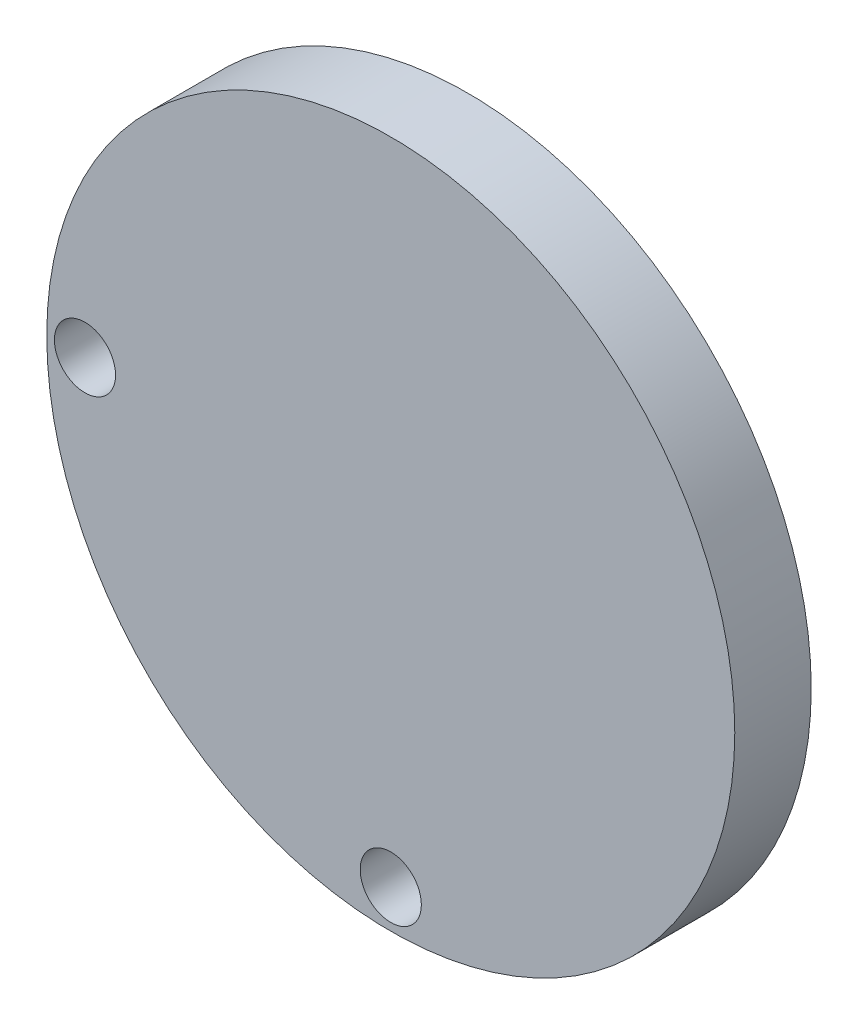
from build123d import *

# Parameters (mm, degrees)
SKETCH1_R           = 45
BOSS_EXTRUDE1_DEPTH = 5
SKETCH2_R           = 4
CUT_EXTRUDE1_DEPTH  = 10


with BuildPart() as part:
    # Sketch1 → Boss-Extrude1 (new, symmetric)
    with BuildSketch(Plane.XY):
        Circle(SKETCH1_R)
    extrude(amount=BOSS_EXTRUDE1_DEPTH, both=True)

    # Sketch2 → Cut-Extrude1 (cut)
    with BuildSketch(Plane.XY.offset(5)):
        with Locations((-40, 0)):
            Circle(SKETCH2_R)
        with Locations((0, -40)):
            Circle(SKETCH2_R)
    extrude(amount=-CUT_EXTRUDE1_DEPTH, mode=Mode.SUBTRACT)


solid = part.part
